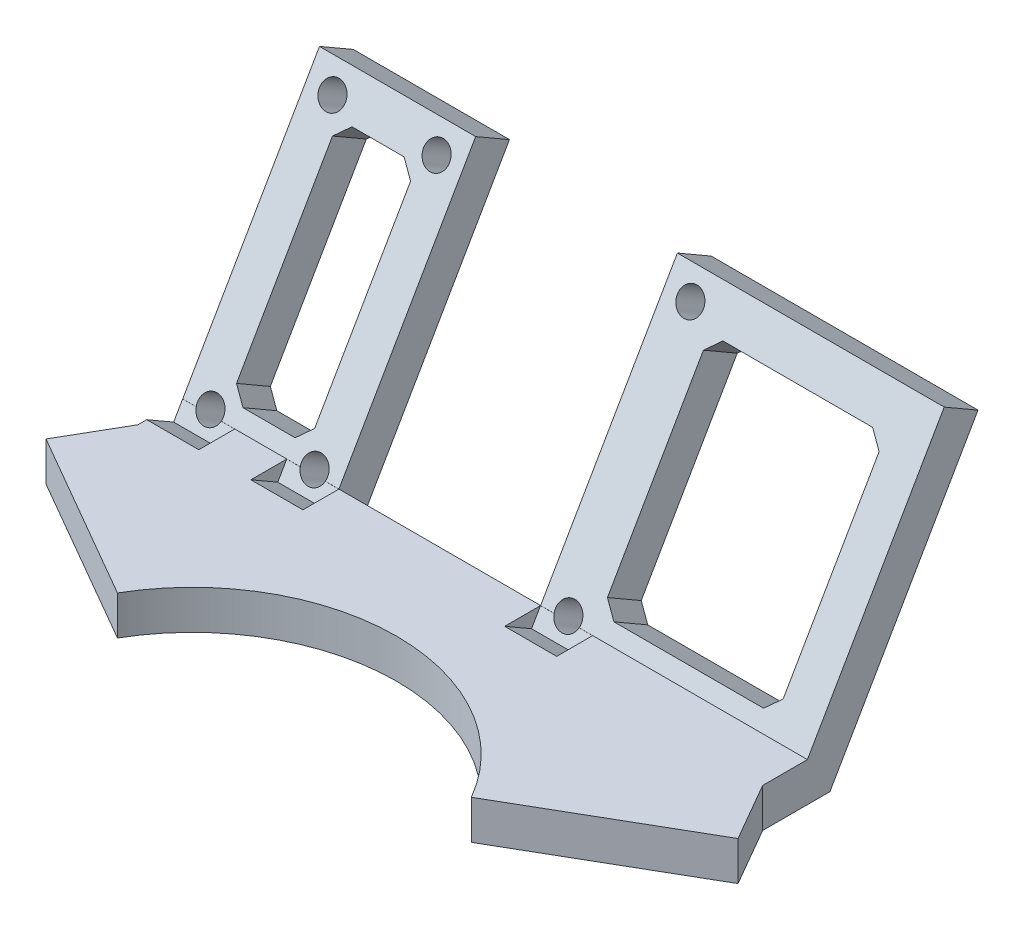
from build123d import *

# Parameters (mm, degrees)
BOSS_EXTRUDE1_DEPTH = 6
SKETCH3_W           = 96
SKETCH3_H           = 45.5
BOSS_EXTRUDE2_DEPTH = 6
CUT_EXTRUDE1_DEPTH  = 6
CUT_EXTRUDE2_DEPTH  = 91.403621508
SKETCH9_W           = 27
SKETCH9_H           = 33.5
CUT_EXTRUDE3_DEPTH  = 91.403621508
CHAMFER1_SIZE       = 2
SKETCH11_R          = 2
CUT_EXTRUDE4_DEPTH  = 91.403621508
CUT_EXTRUDE6_START  = 0.01
SKETCH12_W          = 8
SKETCH12_H          = 6.6
CUT_EXTRUDE6_DEPTH  = 91.493120288


with BuildPart() as part:
    # Sketch2 → Boss-Extrude1 (new body)
    with BuildSketch(Plane(origin=(0, 0, 0), x_dir=(1, 0, 0), z_dir=(0, 1, 0))):
        with BuildLine():
            Line((27.190997647, 15.698729811), (53.17175976, 30.698729811))
            Line((53.17175976, 30.698729811), (48, 39.65648048))
            Line((48, 39.65648048), (48, 50))
            Line((48, 50), (-48, 50))
            Line((-48, 50), (-48, 39.65648048))
            Line((-48, 39.65648048), (-53.17175976, 30.698729811))
            Line((-53.17175976, 30.698729811), (-27.190997647, 15.698729811))
            ThreePointArc((-27.190997647, 15.698729811), (0, 31.397459622), (27.190997647, 15.698729811))
        make_face()
    extrude(amount=BOSS_EXTRUDE1_DEPTH)

    # Sketch3 → Boss-Extrude2 (add)
    with BuildSketch(Plane(origin=(0, -21.650635095, -37.5), x_dir=(-1, 0, 0), z_dir=(0, -0.500000000000001, -0.866025403784438))):
        with Locations((0, 47.75)):
            Rectangle(SKETCH3_W, SKETCH3_H)
    extrude(amount=-BOSS_EXTRUDE2_DEPTH)

    # Sketch4 → Cut-Extrude1 (cut)
    with BuildSketch(Plane(origin=(0, -21.650635095, -37.5), x_dir=(-1, 0, 0), z_dir=(0, -0.5000000000000009, -0.8660254037844383))):
        Polygon((24, 70.5), (24, 25), (24, 15), (-7, 15), (-7, 25), (-7, 70.5), align=None)
    extrude(amount=-CUT_EXTRUDE1_DEPTH, mode=Mode.SUBTRACT)

    # Sketch8 → Cut-Extrude2 (cut, through all)
    with BuildSketch(Plane(origin=(0, -21.650635095, -37.5), x_dir=(-1, 0, 0), z_dir=(0, -0.500000000000001, -0.8660254037844382))):
        Polygon((32, 64.5), (30, 62.5), (30, 33), (32, 31), (40, 31), (42, 33), (42, 62.5), (40, 64.5), align=None)
    extrude(amount=-CUT_EXTRUDE2_DEPTH, mode=Mode.SUBTRACT)

    # Sketch9 → Cut-Extrude3 (cut, through all)
    with BuildSketch(Plane(origin=(0, -21.650635095, -37.5), x_dir=(-1, 0, 0), z_dir=(0, -0.500000000000001, -0.8660254037844382))):
        with Locations((-28.5, 47.75)):
            Rectangle(SKETCH9_W, SKETCH9_H)
    extrude(amount=-CUT_EXTRUDE3_DEPTH, mode=Mode.SUBTRACT)

    # Chamfer1
    chamfer1_edges = [part.edges().sort_by_distance(p)[0] for p in [
        (42, 6.696152423, -50.401923789),
        (15, 6.696152423, -50.401923789),
        (15, 35.708003449, -67.151923789),
        (42, 35.708003449, -67.151923789),
    ]]
    chamfer(chamfer1_edges, length=CHAMFER1_SIZE)

    # Sketch11 → Cut-Extrude4 (cut, through all)
    with BuildSketch(Plane(origin=(0, -21.650635095, -37.5), x_dir=(-1, 0, 0), z_dir=(0, -0.500000000000001, -0.8660254037844382))):
        with Locations((28, 66.5)):
            Circle(SKETCH11_R)
        with Locations((44, 66.5)):
            Circle(SKETCH11_R)
        with Locations((-11, 66.5)):
            Circle(SKETCH11_R)
        with Locations((28, 29)):
            Circle(SKETCH11_R)
        with Locations((44, 29)):
            Circle(SKETCH11_R)
        with Locations((-11, 29)):
            Circle(SKETCH11_R)
    extrude(amount=-CUT_EXTRUDE4_DEPTH, mode=Mode.SUBTRACT)

    # Sketch12 → Cut-Extrude6 (cut, through all)
    with BuildSketch(Plane(origin=(0, -18.650635095, -32.303847577), x_dir=(1, 0, 0), z_dir=(0, 0.500000000000001, 0.8660254037844382)).offset(CUT_EXTRUDE6_START)):
        with Locations((11, 29)):
            Rectangle(SKETCH12_W, SKETCH12_H)
        with Locations((-28, 29)):
            Rectangle(SKETCH12_W, SKETCH12_H)
        with Locations((-44, 29)):
            Rectangle(SKETCH12_W, SKETCH12_H)
    extrude(amount=CUT_EXTRUDE6_DEPTH, mode=Mode.SUBTRACT)


solid = part.part
